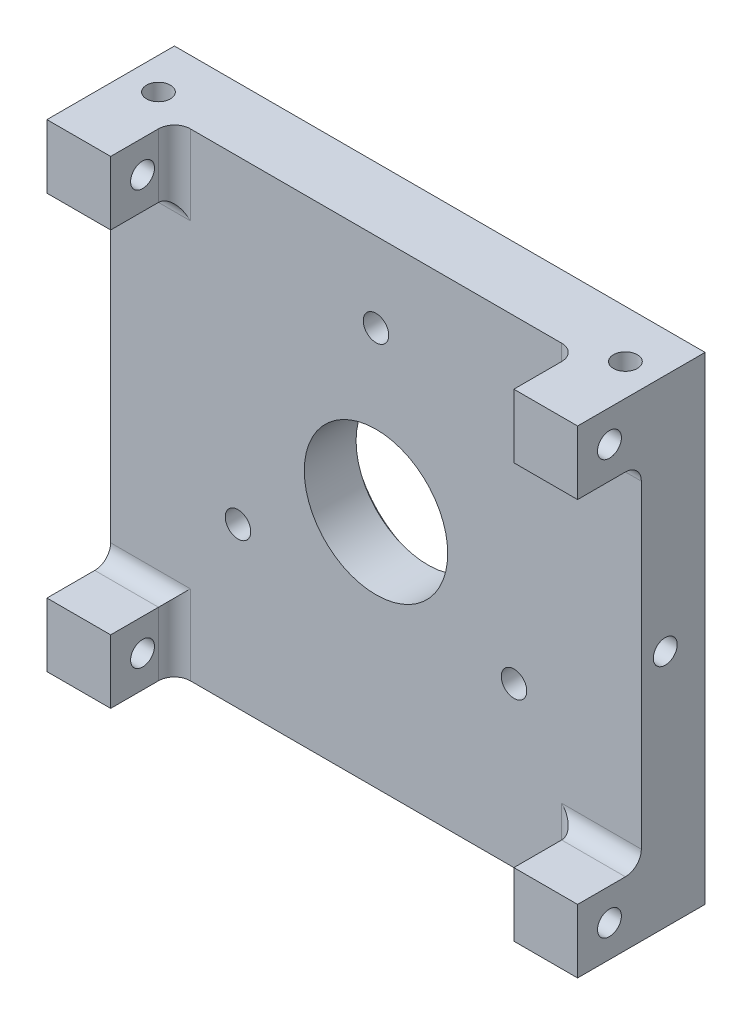
from build123d import *

# Parameters (mm, degrees)
SKETCH_1_W          = 66.6
SKETCH_1_H          = 60
SKETCH_1_R          = 1.6
SKETCH_1_R_2        = 9
EXTRUDE_1_DEPTH     = 8
SKETCH_3_W          = 8
SKETCH_3_H          = 8
EXTRUDE_2_DEPTH     = 8
SKETCH_4_R          = 1.5
CUT_EXTRUDE_1_DEPTH = 8
CUT_EXTRUDE_START   = -8
SKETCH_5_R          = 1.5
CUT_EXTRUDE_2_DEPTH = 8
SKETCH_6_R          = 1.5
CUT_EXTRUDE_3_DEPTH = 8
SKETCH_7_R          = 1.5
CUT_EXTRUDE_4_DEPTH = 8
FILLET_1_R          = 2
SKETCH_8_R          = 11
CUT_EXTRUDE_5_DEPTH = 1.5


with BuildPart() as part:
    # 草图1 → 凸台-拉伸1 (new body)
    with BuildSketch(Plane.XY):
        Rectangle(SKETCH_1_W, SKETCH_1_H)
        with Locations((0, 20)):
            Circle(SKETCH_1_R, mode=Mode.SUBTRACT)
        with Locations((17.320508076, -10)):
            Circle(SKETCH_1_R, mode=Mode.SUBTRACT)
        with Locations((-17.320508076, -10)):
            Circle(SKETCH_1_R, mode=Mode.SUBTRACT)
        Circle(SKETCH_1_R_2, mode=Mode.SUBTRACT)
    extrude(amount=EXTRUDE_1_DEPTH)

    # 草图3 → 凸台-拉伸2 (add)
    with BuildSketch(Plane.XY.offset(8)):
        with Locations((-29.3, 26)):
            Rectangle(SKETCH_3_W, SKETCH_3_H)
        with Locations((-29.3, -26)):
            Rectangle(SKETCH_3_W, SKETCH_3_H)
        with Locations((29.3, -26)):
            Rectangle(SKETCH_3_W, SKETCH_3_H)
        with Locations((29.3, 26)):
            Rectangle(SKETCH_3_W, SKETCH_3_H)
    extrude(amount=EXTRUDE_2_DEPTH)

    # 草图4 → 切除-拉伸1 (cut)
    with BuildSketch(Plane.ZY.offset(33.3)):
        with Locations((12, 26)):
            Circle(SKETCH_4_R)
        with Locations(Location((12, -26, 0), (0, 0, 180))):
            Circle(SKETCH_4_R)
        with Locations((5, 0)):
            Circle(SKETCH_4_R)
    extrude(amount=-CUT_EXTRUDE_1_DEPTH, mode=Mode.SUBTRACT)

    # 草图5 → 切除-拉伸2 (cut)
    with BuildSketch(Plane(origin=(33.3, 0, 0), x_dir=(0, 0, -1), z_dir=(1, 0, 0)).offset(CUT_EXTRUDE_START)):
        with Locations((-12, -26)):
            Circle(SKETCH_5_R)
        with Locations(Location((-12, 26, 0), (0, 0, 180))):
            Circle(SKETCH_5_R)
        with Locations(Location((-5, 0, 0), (0, 0, 180))):
            Circle(SKETCH_5_R)
    extrude(amount=CUT_EXTRUDE_2_DEPTH, mode=Mode.SUBTRACT)

    # 草图6 → 切除-拉伸3 (cut)
    with BuildSketch(Plane(origin=(0, 30, 0), x_dir=(1, 0, 0), z_dir=(0, 1, 0))):
        with Locations(Location((-29.3, -6, 0), (0, 0, 180))):
            Circle(SKETCH_6_R)
        with Locations((29.3, -6)):
            Circle(SKETCH_6_R)
    extrude(amount=-CUT_EXTRUDE_3_DEPTH, mode=Mode.SUBTRACT)

    # 草图7 → 切除-拉伸4 (cut)
    with BuildSketch(Plane.XZ.offset(30).offset(CUT_EXTRUDE_START)):
        with Locations((29.3, 6)):
            Circle(SKETCH_7_R)
        with Locations(Location((-29.3, 6, 0), (0, 0, 180))):
            Circle(SKETCH_7_R)
    extrude(amount=CUT_EXTRUDE_4_DEPTH, mode=Mode.SUBTRACT)

    # 圆角1
    fillet_1_edges = [part.edges().sort_by_distance(p)[0] for p in [
        (-29.3, 22, 8),
        (-25.3, 26, 8),
        (-25.3, -26, 8),
        (-29.3, -22, 8),
        (29.3, -22, 8),
        (25.3, -26, 8),
        (25.3, 26, 8),
        (29.3, 22, 8),
    ]]
    fillet(fillet_1_edges, radius=FILLET_1_R)

    # 草图8 → 切除-拉伸5 (cut)
    with BuildSketch(Plane(origin=(0, 0, 0), x_dir=(-1, 0, 0), z_dir=(0, 0, -1))):
        Circle(SKETCH_8_R)
    extrude(amount=-CUT_EXTRUDE_5_DEPTH, mode=Mode.SUBTRACT)


solid = part.part
